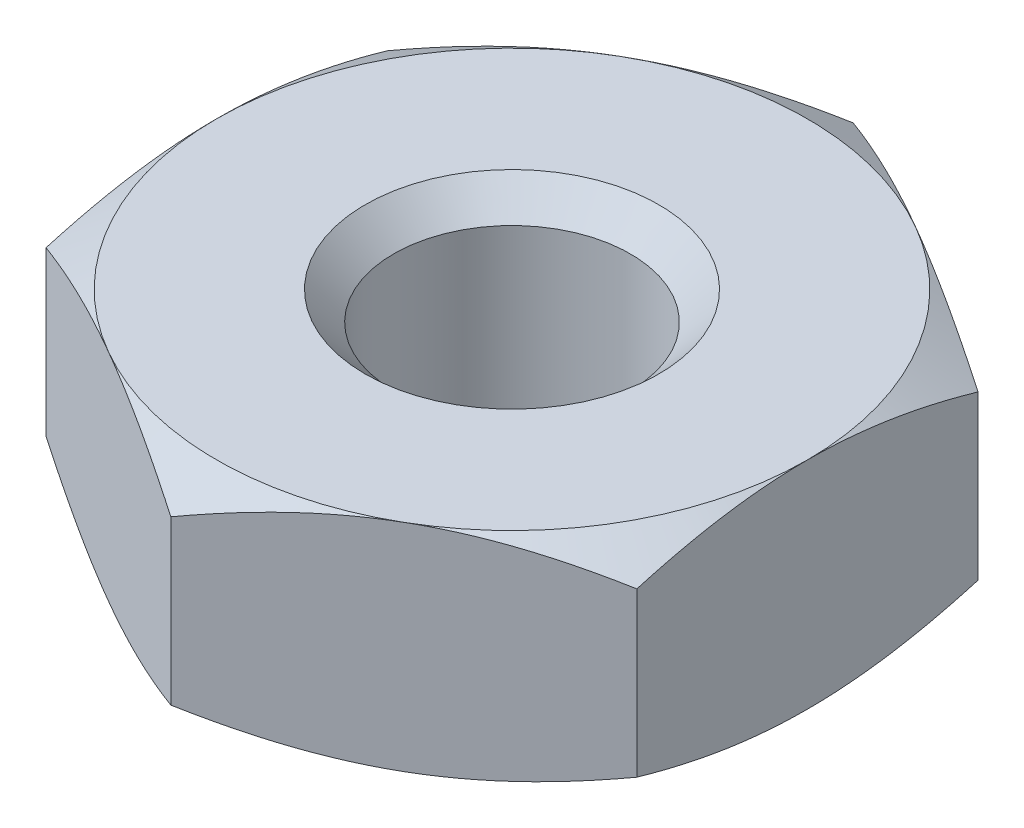
from build123d import *

# Parameters (mm, degrees)
BOSS_EXTRUDE1_DEPTH = 1.4478
SKETCH2_R           = 1.5875
CUT_EXTRUDE1_DEPTH  = 7.709639692
CHAMFER1_SIZE       = 0.381


with BuildPart() as part:
    # Sketch1 → Boss-Extrude1 (new, symmetric)
    with BuildSketch(Plane(origin=(0, 0, 0), x_dir=(1, 0, 0), z_dir=(0, 1, 0))):
        Polygon((3.9624, -2.287692707), (3.9624, 2.287692707), (0, 4.575385413), (-3.9624, 2.287692707), (-3.9624, -2.287692707), (0, -4.575385413), align=None)
    extrude(amount=BOSS_EXTRUDE1_DEPTH, both=True)

    # Sketch2 → Cut-Extrude1 (cut, through all)
    with BuildSketch(Plane(origin=(0, 1.4478, 0), x_dir=(1, 0, 0), z_dir=(0, 1, 0))):
        with Locations(Location((0, 0, 0), (0, 0, 270))):
            Circle(SKETCH2_R)
    extrude(amount=-CUT_EXTRUDE1_DEPTH, mode=Mode.SUBTRACT)

    # Sketch3 → Cut-Revolve1 (revolve, cut)
    with BuildSketch(Plane(origin=(0, 0, 0), x_dir=(0, 0, -1), z_dir=(1, 0, 0))):
        Polygon((-4.575385413, -1.4478), (-4.575385413, -1.093892707), (-3.9624, -1.4478), align=None)
    cut_revolve1 = revolve(axis=Axis((0, 0, 0), (0, -1, 0)), mode=Mode.SUBTRACT)

    # Mirror1: Cut-Revolve1 across plane
    add(cut_revolve1.mirror(Plane.ZX), mode=Mode.SUBTRACT)

    # Chamfer1
    chamfer1_edges = [part.edges().sort_by_distance(p)[0] for p in [
        (0, -1.4478, -1.5875),
        (0, 1.4478, -1.5875),
    ]]
    chamfer(chamfer1_edges, length=CHAMFER1_SIZE)


solid = part.part
